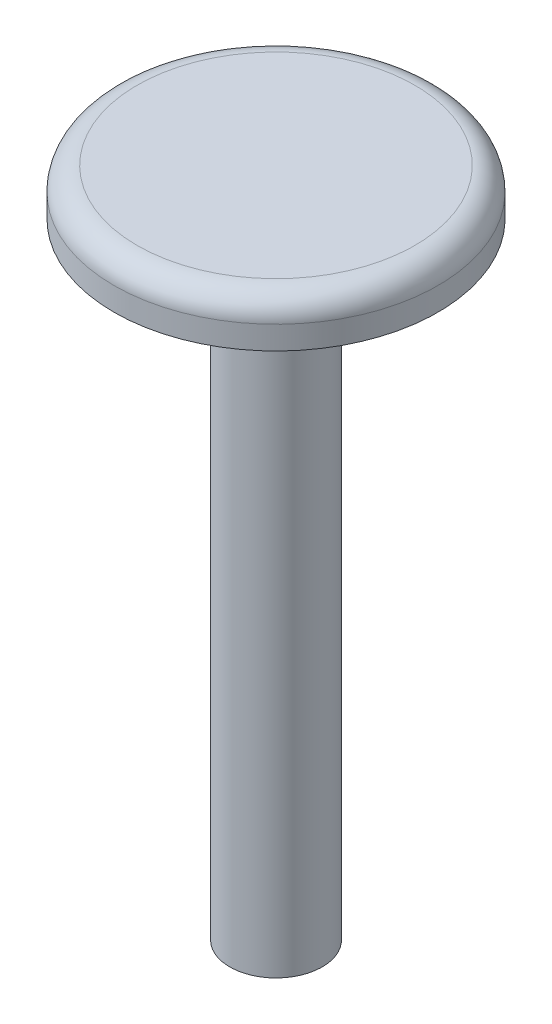
from build123d import *

# Parameters (mm, degrees)
SKETCH1_R           = 35
BOSS_EXTRUDE1_DEPTH = 10
SKETCH2_R           = 10
BOSS_EXTRUDE2_DEPTH = 135
FILLET1_R           = 5


with BuildPart() as part:
    # Sketch1 → Boss-Extrude1 (new body)
    with BuildSketch(Plane(origin=(0, 0, 0), x_dir=(1, 0, 0), z_dir=(0, 1, 0))):
        with Locations(Location((0, 0, 0), (0, 0, 270))):
            Circle(SKETCH1_R)
    extrude(amount=BOSS_EXTRUDE1_DEPTH)

    # Sketch2 → Boss-Extrude2 (add)
    with BuildSketch(Plane.XZ):
        with Locations(Location((0, 0, 0), (0, 0, 270))):
            Circle(SKETCH2_R)
    extrude(amount=BOSS_EXTRUDE2_DEPTH)

    # Fillet1
    fillet1_edges = [part.edges().sort_by_distance(p)[0] for p in [
        (0, 10, -35),
    ]]
    fillet(fillet1_edges, radius=FILLET1_R)


solid = part.part
